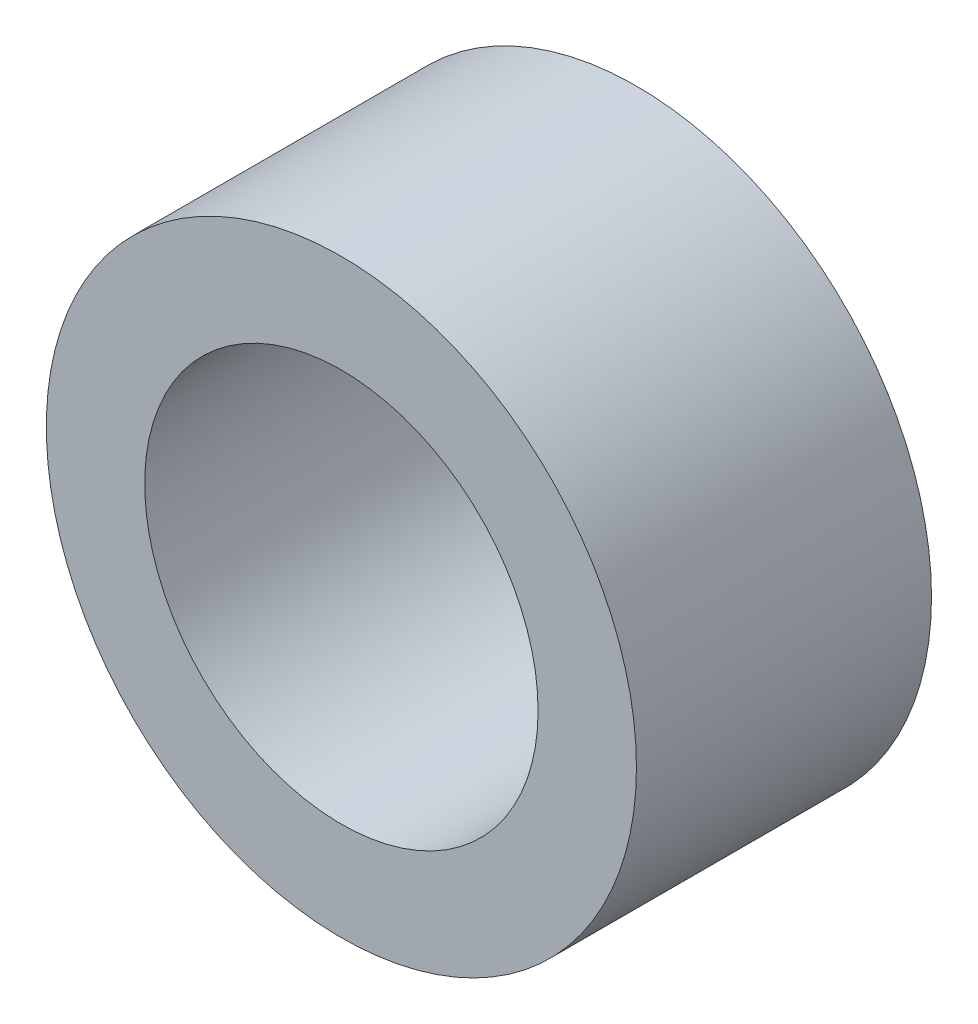
from build123d import *

# Parameters (mm, degrees)
SKETCH1_R           = 3
SKETCH1_R_2         = 2
BOSS_EXTRUDE1_DEPTH = 1.5


with BuildPart() as part:
    # Sketch1 → Boss-Extrude1 (new, symmetric)
    with BuildSketch(Plane.XY):
        Circle(SKETCH1_R)
        Circle(SKETCH1_R_2, mode=Mode.SUBTRACT)
    extrude(amount=BOSS_EXTRUDE1_DEPTH, both=True)


solid = part.part
